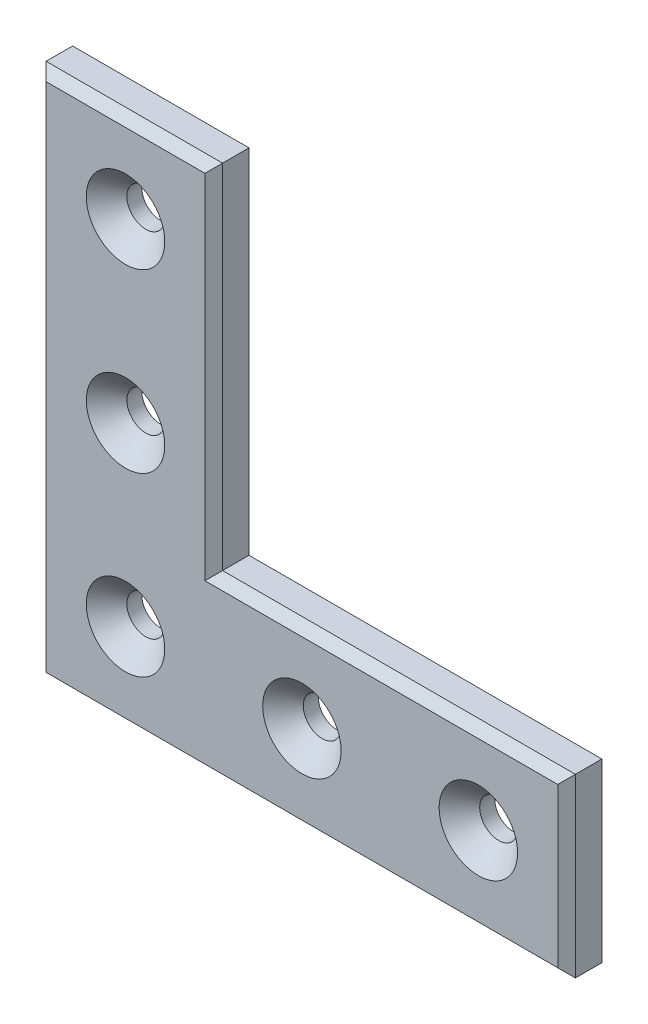
from build123d import *

# Parameters (mm, degrees)
SKETCH1_R           = 2.15
BOSS_EXTRUDE1_DEPTH = 4
CHAMFER1_SIZE       = 1
CHAMFER2_SIZE       = 2.3


with BuildPart() as part:
    # Sketch1 → Boss-Extrude1 (new body)
    with BuildSketch(Plane.XY):
        Polygon((50, -10), (50, 10), (10, 10), (10, 50), (-10, 50), (-10, 10), (-10, -10), align=None)
        with Locations((0, 20)):
            Circle(SKETCH1_R, mode=Mode.SUBTRACT)
        with Locations((20, 0)):
            Circle(SKETCH1_R, mode=Mode.SUBTRACT)
        with Locations((0, 40)):
            Circle(SKETCH1_R, mode=Mode.SUBTRACT)
        Circle(SKETCH1_R, mode=Mode.SUBTRACT)
        with Locations((40, 0)):
            Circle(SKETCH1_R, mode=Mode.SUBTRACT)
    extrude(amount=BOSS_EXTRUDE1_DEPTH)

    # Chamfer1
    chamfer1_edges = [part.edges().sort_by_distance(p)[0] for p in [
        (0, 50, 4),
        (-10, 20, 4),
        (20, -10, 4),
        (50, 0, 4),
        (30, 10, 4),
        (10, 30, 4),
    ]]
    chamfer(chamfer1_edges, length=CHAMFER1_SIZE)

    # Chamfer2
    chamfer2_edges = [part.edges().sort_by_distance(p)[0] for p in [
        (17.85, 0, 4),
        (-2.15, 20, 4),
        (-2.15, 40, 4),
        (-2.15, 0, 4),
        (37.85, 0, 4),
    ]]
    chamfer(chamfer2_edges, length=CHAMFER2_SIZE)


solid = part.part
